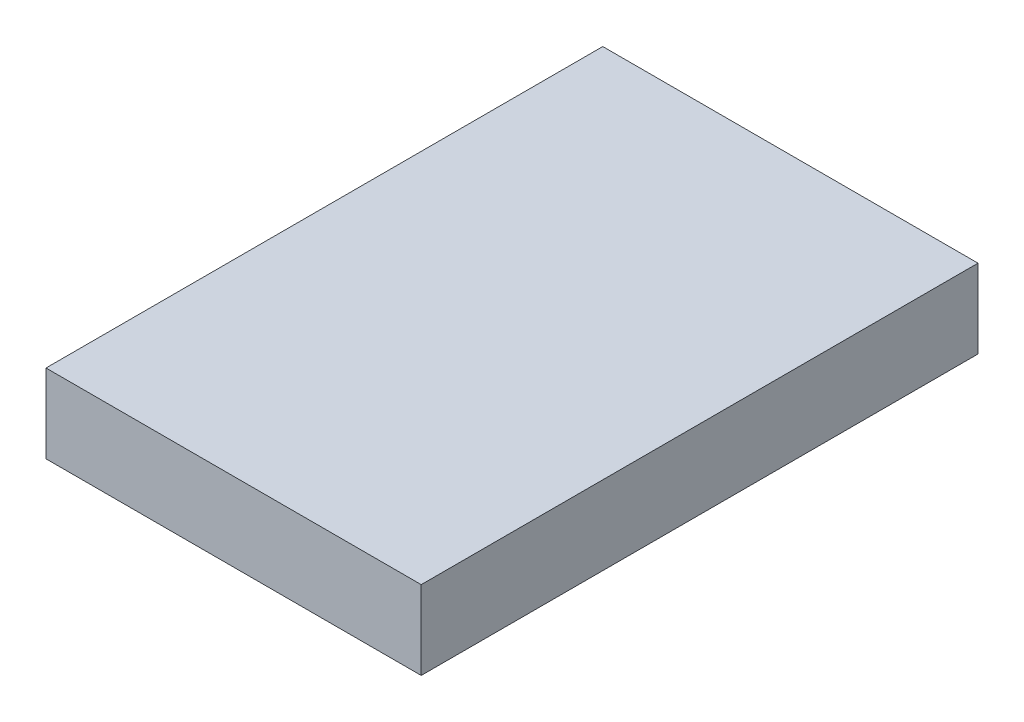
from build123d import *

# Parameters (mm, degrees)
SKETCH1_W           = 78.74
SKETCH1_H           = 116.84
BOSS_EXTRUDE1_DEPTH = 16.51


with BuildPart() as part:
    # Sketch1 → Boss-Extrude1 (new body)
    with BuildSketch(Plane(origin=(0, 0, 0), x_dir=(1, 0, 0), z_dir=(0, 1, 0))):
        Rectangle(SKETCH1_W, SKETCH1_H)
    extrude(amount=BOSS_EXTRUDE1_DEPTH)


solid = part.part
